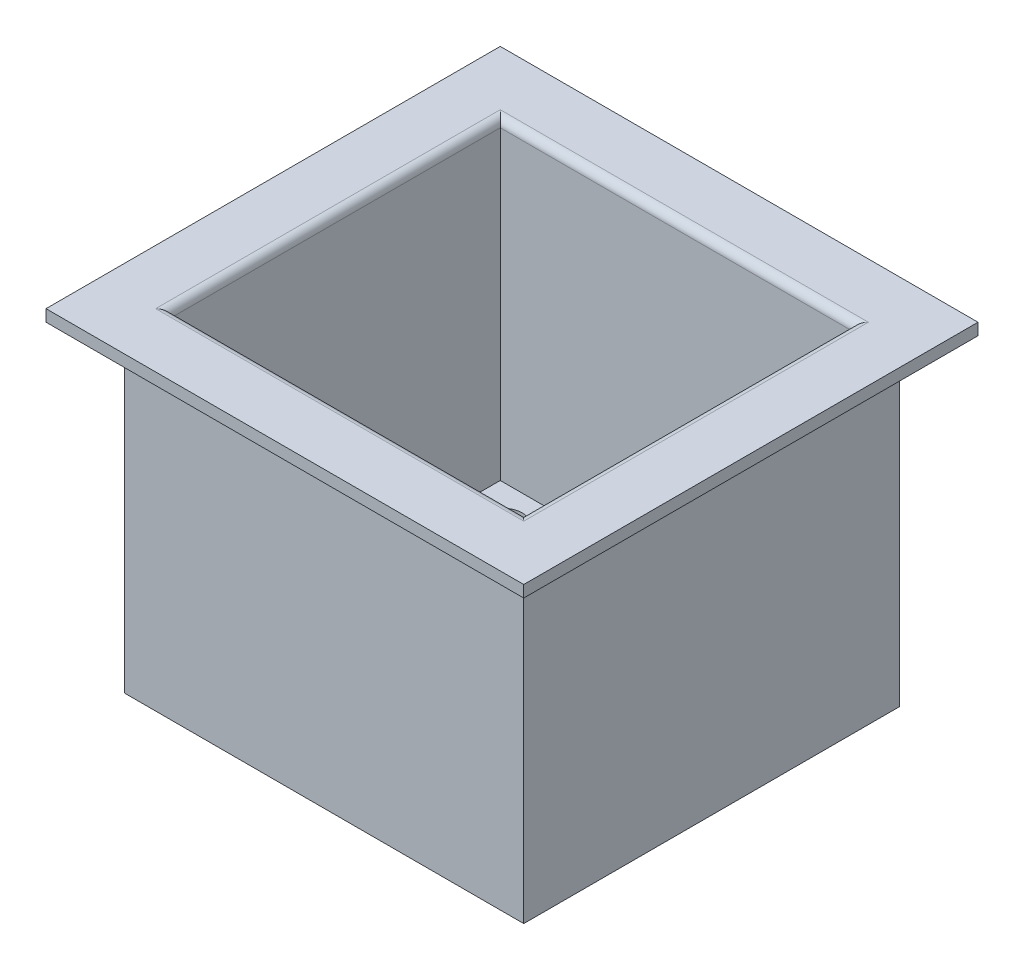
from build123d import *

# Parameters (mm, degrees)
SKETCH1_W           = 102
SKETCH1_H           = 96
BOSS_EXTRUDE1_DEPTH = 85
SKETCH3_W           = 90
SKETCH3_H           = 84
CUT_EXTRUDE2_DEPTH  = 80
SKETCH4_W           = 122
SKETCH4_H           = 116
SKETCH4_W_2         = 102
SKETCH4_H_2         = 96
BOSS_EXTRUDE2_DEPTH = 3
SKETCH5_R           = 15
SKETCH5_R_2         = 10
BOSS_EXTRUDE3_DEPTH = 10
CUT_EXTRUDE3_START  = -10
SKETCH8_R           = 10
CUT_EXTRUDE3_DEPTH  = 10
SKETCH9_R           = 1.5
CUT_EXTRUDE4_DEPTH  = 80
SKETCH10_R          = 5
CUT_EXTRUDE_1_DEPTH = 1
FILLET_2_R          = 2


with BuildPart() as part:
    # Sketch1 → Boss-Extrude1 (new body)
    with BuildSketch(Plane(origin=(0, 0, 0), x_dir=(1, 0, 0), z_dir=(0, 1, 0))):
        with Locations((-37.407979351, -6.16081108)):
            Rectangle(SKETCH1_W, SKETCH1_H)
    extrude(amount=BOSS_EXTRUDE1_DEPTH)

    # Sketch3 → Cut-Extrude2 (cut)
    with BuildSketch(Plane(origin=(0, 85, 0), x_dir=(1, 0, 0), z_dir=(0, 1, 0))):
        with Locations((-37.407979351, -6.16081108)):
            Rectangle(SKETCH3_W, SKETCH3_H)
    extrude(amount=-CUT_EXTRUDE2_DEPTH, mode=Mode.SUBTRACT)

    # Sketch4 → Boss-Extrude2 (add)
    with BuildSketch(Plane(origin=(0, 85, 0), x_dir=(1, 0, 0), z_dir=(0, 1, 0))):
        with Locations((-37.407979351, -6.16081108)):
            Rectangle(SKETCH4_W, SKETCH4_H)
        with Locations((-37.407979351, -6.16081108)):
            Rectangle(SKETCH4_W_2, SKETCH4_H_2, mode=Mode.SUBTRACT)
    extrude(amount=-BOSS_EXTRUDE2_DEPTH)

    # Sketch5 → Boss-Extrude3 (add)
    with BuildSketch(Plane(origin=(0, 5, 0), x_dir=(1, 0, 0), z_dir=(0, 1, 0))):
        with Locations(Location((-37.407979351, -6.16081108, 0), (0, 0, 270))):
            Circle(SKETCH5_R)
        with Locations(Location((-37.407979351, -6.16081108, 0), (0, 0, 270))):
            Circle(SKETCH5_R_2, mode=Mode.SUBTRACT)
    extrude(amount=BOSS_EXTRUDE3_DEPTH)

    # Sketch8 → Cut-Extrude3 (cut)
    with BuildSketch(Plane(origin=(0, 5, 0), x_dir=(1, 0, 0), z_dir=(0, 1, 0)).offset(CUT_EXTRUDE3_START)):
        with Locations(Location((-37.407979351, -6.16081108, 0), (0, 0, 270))):
            Circle(SKETCH8_R)
    extrude(amount=CUT_EXTRUDE3_DEPTH, mode=Mode.SUBTRACT)

    # Sketch9 → Cut-Extrude4 (cut)
    with BuildSketch(Plane.ZY.offset(-7.592020649)):
        with Locations(Location((6.16081108, 10, 0), (0, 0, 180))):
            Circle(SKETCH9_R)
    extrude(amount=CUT_EXTRUDE4_DEPTH, mode=Mode.SUBTRACT)

    # Sketch10 → 切除-拉伸1 (cut)
    with BuildSketch(Plane(origin=(0, 5, 0), x_dir=(1, 0, 0), z_dir=(0, 1, 0))):
        with Locations(Location((-2.407979351, 26.487445273, 0), (0, 0, 270))):
            Circle(SKETCH10_R)
        with Locations(Location((-2.407979351, -38.827477746, 0), (0, 0, 270))):
            Circle(SKETCH10_R)
        with Locations(Location((-72.407979351, -38.827477746, 0), (0, 0, 270))):
            Circle(SKETCH10_R)
        with Locations(Location((-72.407979351, 26.487445273, 0), (0, 0, 270))):
            Circle(SKETCH10_R)
    extrude(amount=-CUT_EXTRUDE_1_DEPTH, mode=Mode.SUBTRACT)

    # 圆角2
    fillet_2_edges = [part.edges().sort_by_distance(p)[0] for p in [
        (-37.407979351, 85, -35.83918892),
        (-82.407979351, 85, 6.16081108),
        (-37.407979351, 85, 48.16081108),
        (7.592020649, 85, 6.16081108),
    ]]
    fillet(fillet_2_edges, radius=FILLET_2_R)


solid = part.part
